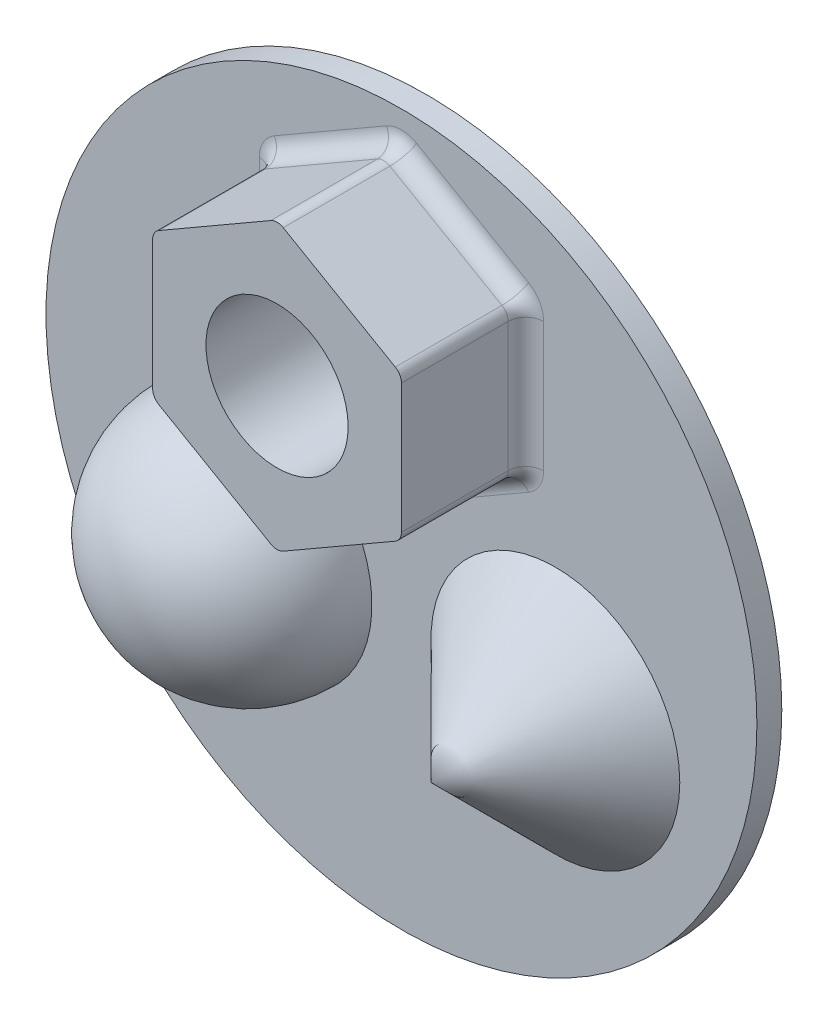
from build123d import *

# Parameters (mm, degrees)
SKETCH1_R           = 10
BOSS_EXTRUDE1_DEPTH = 0.7
REVOLVE1_ANGLE      = 180
SKETCH2_5_R         = 3.5
BOSS_EXTRUDE2_DEPTH = 5
BOSS_EXTRUDE2_TAPER = 45
BOSS_EXTRUDE3_DEPTH = 3.5
FILLET1_R           = 0.35
SKETCH3_R           = 2
CUT_EXTRUDE1_DEPTH  = 10
FILLET2_R           = 0.5


with BuildPart() as part:
    # Sketch1 → Boss-Extrude1 (new body)
    with BuildSketch(Plane.XY):
        Circle(SKETCH1_R)
    extrude(amount=BOSS_EXTRUDE1_DEPTH)

    # Sketch2 → Revolve1 (revolve)
    with BuildSketch(Plane.XY.offset(0.7)):
        with BuildLine():
            Line((-4.330127019, -6), (-4.330127019, 1))
            ThreePointArc((-4.330127019, 1), (-7.830127019, -2.5), (-4.330127019, -6))
        make_face()
    revolve(axis=Axis((-4.330127019, -6, 0.7), (0, 1, 0)), revolution_arc=REVOLVE1_ANGLE)

    # Sketch2<5> → Boss-Extrude2 (add)
    with BuildSketch(Plane.XY.offset(0.7)):
        with Locations((4.330127019, -2.5)):
            Circle(SKETCH2_5_R)
    extrude(amount=BOSS_EXTRUDE2_DEPTH, taper=BOSS_EXTRUDE2_TAPER)

    # Sketch2<6> → Boss-Extrude3 (add)
    with BuildSketch(Plane.XY.offset(0.7)):
        Polygon((0, 0.958548116), (3.5, 2.979274058), (3.5, 7.020725942), (0, 9.041451884), (-3.5, 7.020725942), (-3.5, 2.979274058), align=None)
    extrude(amount=BOSS_EXTRUDE3_DEPTH)

    # Fillet1
    fillet1_edges = [part.edges().sort_by_distance(p)[0] for p in [
        (-3.5, 7.020725942, 2.45),
        (-3.5, 2.979274058, 2.45),
        (0, 0.958548116, 2.45),
        (3.5, 2.979274058, 2.45),
        (3.5, 7.020725942, 2.45),
        (0, 9.041451884, 2.45),
    ]]
    fillet(fillet1_edges, radius=FILLET1_R)

    # Sketch3 → Cut-Extrude1 (cut)
    with BuildSketch(Plane.XY.offset(4.2)):
        with Locations((0, 5)):
            Circle(SKETCH3_R)
    extrude(amount=-CUT_EXTRUDE1_DEPTH, mode=Mode.SUBTRACT)

    # Fillet2
    fillet2_edges = [part.edges().sort_by_distance(p)[0] for p in [
        (-1.75, 8.031088913, 0.7),
        (1.75, 8.031088913, 0.7),
        (-3.5, 5, 0.7),
        (-1.75, 1.968911087, 0.7),
        (3.5, 5, 0.7),
        (1.75, 1.968911087, 0.7),
        (0, 8.987306696, 0.7),
        (-3.453108891, 6.993653348, 0.7),
        (-3.453108891, 3.006346652, 0.7),
        (3.453108891, 6.993653348, 0.7),
        (3.453108891, 3.006346652, 0.7),
        (0, 1.012693304, 0.7),
    ]]
    fillet(fillet2_edges, radius=FILLET2_R)

    # Cut-Extrude2 cone 1 section (through the dimple's axis) → Cut-Extrude2 (revolve, cut)
    with BuildSketch(Plane(origin=(4.330127019, -2.5, 0), x_dir=(0, 1, 0), z_dir=(1, 0, 0))):
        Polygon((0, 0), (2, 0), (0, 2), align=None)
    revolve(axis=Axis((4.330127019, -2.5, 0), (0, 0, 1)), mode=Mode.SUBTRACT)


solid = part.part
